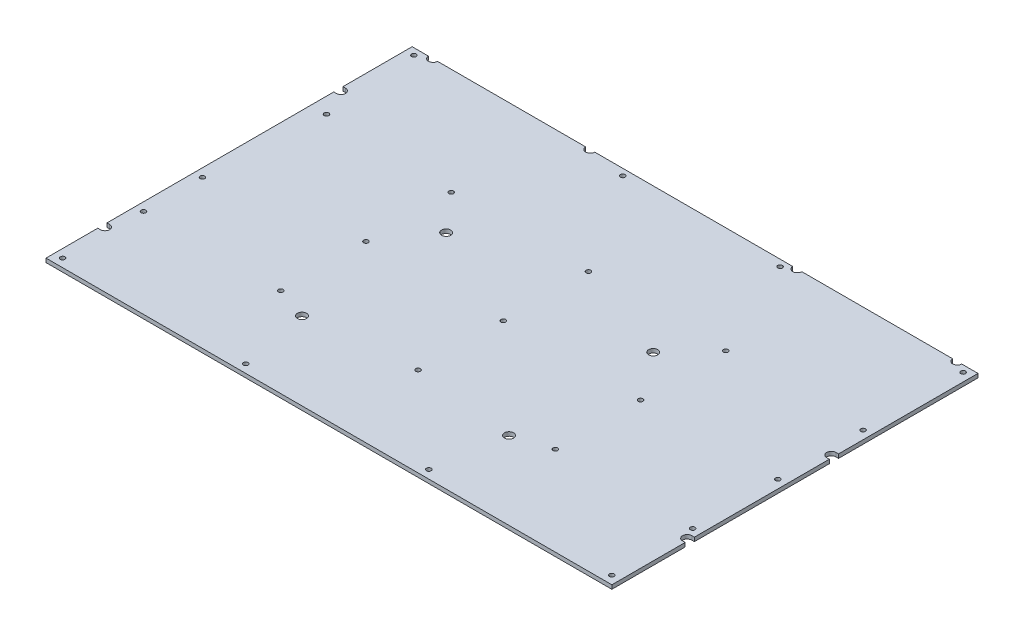
from build123d import *

# Parameters (mm, degrees)
SKETCH1_W            = 431.8
SKETCH1_H            = 294.7
BOSS_EXTRUDE1_DEPTH  = 3
SKETCH2_R            = 1.775
CUT_EXTRUDE1_DEPTH   = 262.407407125
LPATTERN1_COUNT      = 4
LPATTERN1_PITCH      = 139.7
SKETCH3_R            = 1.775
CUT_EXTRUDE2_DEPTH   = 262.407407125
LPATTERN2_COUNT      = 5
LPATTERN2_PITCH      = 104.77
LPATTERN2_COUNT_DIR2 = 3
LPATTERN2_PITCH_DIR2 = 65
SKETCH4_R            = 1.775
CUT_EXTRUDE3_DEPTH   = 10
SKETCH7_R            = 3.5
CUT_EXTRUDE5_DEPTH   = 262.407407125
SKETCH8_W            = 2
SKETCH8_H            = 7
CUT_EXTRUDE6_DEPTH   = 262.407407125
SKETCH9_W            = 431.8
SKETCH9_H            = 15.3
CUT_EXTRUDE7_DEPTH   = 262.407407125
SKETCH11_R           = 1.775
BOSS_EXTRUDE3_DEPTH  = 3
SKETCH12_R           = 1.775
CUT_EXTRUDE8_DEPTH   = 262.407407125


with BuildPart() as part:
    # Sketch1 → Boss-Extrude1 (new body)
    with BuildSketch(Plane(origin=(0, 0, 0), x_dir=(1, 0, 0), z_dir=(0, 1, 0))):
        Rectangle(SKETCH1_W, SKETCH1_H)
    extrude(amount=BOSS_EXTRUDE1_DEPTH)

    # Sketch2 → Cut-Extrude1 (cut, through all)
    with BuildSketch(Plane(origin=(0, 3, 0), x_dir=(1, 0, 0), z_dir=(0, 1, 0))):
        with Locations(Location((-209.55, -125.7, 0), (0, 0, 270))):
            Circle(SKETCH2_R)
        with Locations(Location((-209.55, 142.35, 0), (0, 0, 270))):
            Circle(SKETCH2_R)
    cut_extrude1 = extrude(amount=-CUT_EXTRUDE1_DEPTH, mode=Mode.SUBTRACT)

    # LPattern1: Cut-Extrude1 ×4
    with Locations(*[(i * LPATTERN1_PITCH, 0, 0) for i in range(1, LPATTERN1_COUNT)]):
        add(cut_extrude1, mode=Mode.SUBTRACT)

    # Sketch3 → Cut-Extrude2 (cut, through all)
    with BuildSketch(Plane(origin=(0, 3, 0), x_dir=(1, 0, 0), z_dir=(0, 1, 0))):
        with Locations(Location((-209.55, -64, 0), (0, 0, 270))):
            Circle(SKETCH3_R)
    cut_extrude2 = extrude(amount=-CUT_EXTRUDE2_DEPTH, mode=Mode.SUBTRACT)

    # LPattern2: Cut-Extrude2 5 × 3, 2 skipped
    with Locations(*[(i * LPATTERN2_PITCH, 0, -j * LPATTERN2_PITCH_DIR2) for i in range(LPATTERN2_COUNT) for j in range(LPATTERN2_COUNT_DIR2) if (i, j) not in ((0, 0), (0, 1), (0, 2))]):
        add(cut_extrude2, mode=Mode.SUBTRACT)

    # Sketch4 → Cut-Extrude3 (cut)
    with BuildSketch(Plane(origin=(0, 3, 0), x_dir=(1, 0, 0), z_dir=(0, 1, 0))):
        with Locations(Location((-203.9, 70, 0), (0, 0, 270))):
            Circle(SKETCH4_R)
        with Locations(Location((-209.55, -19, 0), (0, 0, 270))):
            Circle(SKETCH4_R)
    extrude(amount=-CUT_EXTRUDE3_DEPTH, mode=Mode.SUBTRACT)

    # Sketch7 → Cut-Extrude5 (cut, through all)
    with BuildSketch(Plane.XZ):
        with Locations((-213.9, -91.03606243)):
            Circle(SKETCH7_R)
        with Locations((-213.9, 89.011457357)):
            Circle(SKETCH7_R)
        with Locations((213.9, 72.58)):
            Circle(SKETCH7_R)
        with Locations((213.9, -37.42)):
            Circle(SKETCH7_R)
        with Locations((200, -147.42)):
            Circle(SKETCH7_R)
        with Locations((78, -147.42)):
            Circle(SKETCH7_R)
        with Locations((-80, -147.42)):
            Circle(SKETCH7_R)
        with Locations(Location((-80, -37.42, 0), (0, 0, 270))):
            Circle(SKETCH7_R)
        with Locations(Location((78, -37.42, 0), (0, 0, 270))):
            Circle(SKETCH7_R)
        with Locations(Location((78, 72.58, 0), (0, 0, 270))):
            Circle(SKETCH7_R)
        with Locations(Location((-80, 72.58, 0), (0, 0, 270))):
            Circle(SKETCH7_R)
        with Locations((-200, -147.42)):
            Circle(SKETCH7_R)
    extrude(amount=-CUT_EXTRUDE5_DEPTH, mode=Mode.SUBTRACT)

    # Sketch8 → Cut-Extrude6 (cut, through all)
    with BuildSketch(Plane(origin=(0, 3, 0), x_dir=(1, 0, 0), z_dir=(0, 1, 0))):
        with Locations((214.9, 37.42)):
            Rectangle(SKETCH8_W, SKETCH8_H)
        with Locations((214.9, -72.58)):
            Rectangle(SKETCH8_W, SKETCH8_H)
        with Locations((-214.9, 91.03606243)):
            Rectangle(SKETCH8_W, SKETCH8_H)
        with Locations((-214.9, -89.011457357)):
            Rectangle(SKETCH8_W, SKETCH8_H)
    extrude(amount=-CUT_EXTRUDE6_DEPTH, mode=Mode.SUBTRACT)

    # Sketch9 → Cut-Extrude7 (cut, through all)
    with BuildSketch(Plane.XZ):
        with Locations((0, 139.7)):
            Rectangle(SKETCH9_W, SKETCH9_H)
    extrude(amount=-CUT_EXTRUDE7_DEPTH, mode=Mode.SUBTRACT)

    # Sketch11 → Boss-Extrude3 (add)
    with BuildSketch(Plane(origin=(0, 3, 0), x_dir=(1, 0, 0), z_dir=(0, 1, 0))):
        with Locations((-69.85, 142.35)):
            Circle(SKETCH11_R)
    extrude(amount=-BOSS_EXTRUDE3_DEPTH)

    # Sketch12 → Cut-Extrude8 (cut, through all)
    with BuildSketch(Plane(origin=(0, 3, 0), x_dir=(1, 0, 0), z_dir=(0, 1, 0))):
        with Locations(Location((-50.15, 142.35, 0), (0, 0, 270))):
            Circle(SKETCH12_R)
    extrude(amount=-CUT_EXTRUDE8_DEPTH, mode=Mode.SUBTRACT)


solid = part.part
